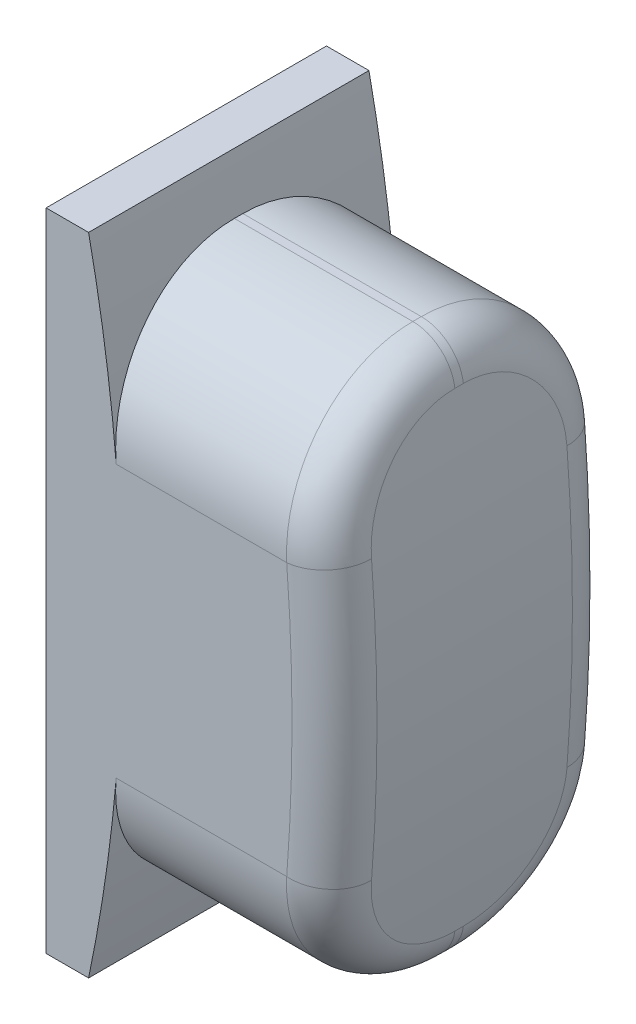
from build123d import *

# Parameters (mm, degrees)
BOSS_EXTRUDE1_DEPTH = 1.65
FILLET1_R           = 1.6
FILLET2_R           = 0.5


with BuildPart() as part:
    # Sketch1 → Boss-Extrude1 (new, symmetric)
    with BuildSketch(Plane.XY):
        with BuildLine():
            Line((18.221141567, 3.2), (20.754758491, 3.2))
            ThreePointArc((20.754758491, 3.2), (21, 0), (20.754758491, -3.2))
            Line((20.754758491, -3.2), (18.221141567, -3.2))
            ThreePointArc((18.221141567, -3.2), (18.165810143, -3.500477375), (18.105524019, -3.8))
            Line((18.105524019, -3.8), (17.605524019, -3.8))
            Line((17.605524019, -3.8), (17.605524019, 3.8))
            Line((17.605524019, 3.8), (18.105524019, 3.8))
            ThreePointArc((18.105524019, 3.8), (18.165810143, 3.500477375), (18.221141567, 3.2))
        make_face()
    extrude(amount=BOSS_EXTRUDE1_DEPTH, both=True)

    # Fillet1
    fillet1_edges = [part.edges().sort_by_distance(p)[0] for p in [
        (19.487950029, 3.2, -1.65),
        (19.487950029, -3.2, 1.65),
        (19.487950029, 3.2, 1.65),
        (19.487950029, -3.2, -1.65),
    ]]
    fillet(fillet1_edges, radius=FILLET1_R)

    # Fillet2
    fillet2_edges = [part.edges().sort_by_distance(p)[0] for p in [
        (21, 0, 1.65),
        (21, 0, -1.65),
        (20.754758491, 3.2, 0),
        (20.754758491, -3.2, 0),
        (20.821763727, 2.730229949, 1.182510681),
        (20.821763726, 2.730229907, -1.182510644),
        (20.821763721, -2.730229944, -1.182510607),
        (20.821763721, -2.730229942, 1.182510608),
    ]]
    fillet(fillet2_edges, radius=FILLET2_R)


solid = part.part
